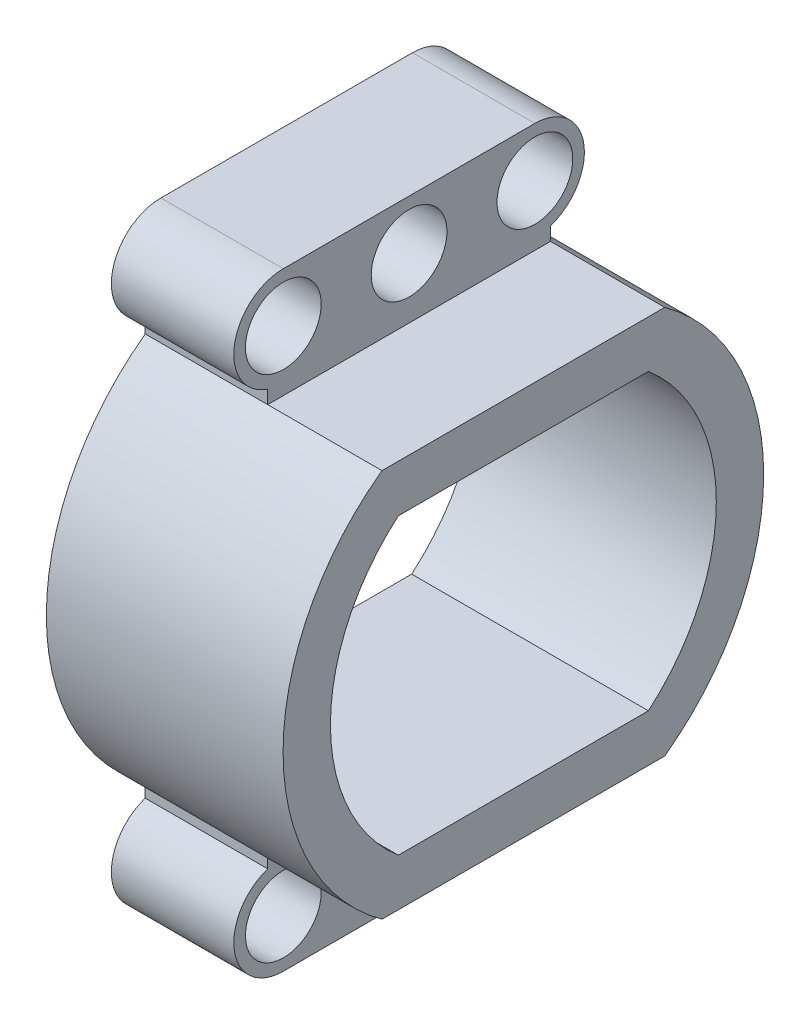
from build123d import *

# Parameters (mm, degrees)
MOTOR_HOLDER_DEPTH = 15
SKETCH2_R          = 2.4
LEGO_MOUNT_DEPTH   = 7.76


with BuildPart() as part:
    # Sketch1 → Motor Holder (new body)
    with BuildSketch(Plane(origin=(0, 0, 0), x_dir=(0, 0, -1), z_dir=(1, 0, 0))):
        with BuildLine():
            Line((-8.959047103, 12.31), (8.959047103, 12.31))
            ThreePointArc((8.959047103, 12.31), (15.225, 0), (8.959047103, -12.31))
            Line((8.959047103, -12.31), (-8.959047103, -12.31))
            ThreePointArc((-8.959047103, -12.31), (-15.225, 0), (-8.959047103, 12.31))
        make_face()
        with BuildLine():
            Line((-7.923037612, 9.31), (7.923037612, 9.31))
            ThreePointArc((7.923037612, 9.31), (12.225, 0), (7.923037612, -9.31))
            Line((7.923037612, -9.31), (-7.923037612, -9.31))
            ThreePointArc((-7.923037612, -9.31), (-12.225, 0), (-7.923037612, 9.31))
        make_face(mode=Mode.SUBTRACT)
    extrude(amount=MOTOR_HOLDER_DEPTH)

    # Sketch2 → Lego Mount (add)
    # profile 1 of 2: a face of its own
    with BuildSketch(Plane.ZY):
        with BuildLine():
            Line((-7.97, 19.277326297), (7.97, 19.277326297))
            ThreePointArc((7.97, 19.277326297), (11.067073538, 16.640950889), (8.959047103, 13.162651831))
            Line((8.959047103, 13.162651831), (8.959047103, 12.31))
            Line((8.959047103, 12.31), (-8.959047103, 12.31))
            Line((-8.959047103, 12.31), (-8.959047103, 13.162651831))
            ThreePointArc((-8.959047103, 13.162651831), (-11.067073538, 16.640950889), (-7.97, 19.277326297))
        make_face()
        with Locations((-7.97, 16.14)):
            Circle(SKETCH2_R, mode=Mode.SUBTRACT)
        with Locations((0, 16.14)):
            Circle(SKETCH2_R, mode=Mode.SUBTRACT)
        with Locations((7.97, 16.14)):
            Circle(SKETCH2_R, mode=Mode.SUBTRACT)
    # profile 2 of 2: a face of its own
    with BuildSketch(Plane.ZY):
        with BuildLine():
            Line((-7.97, -19.277326297), (7.97, -19.277326297))
            ThreePointArc((7.97, -19.277326297), (11.067073538, -16.640950889), (8.959047103, -13.162651831))
            Line((8.959047103, -13.162651831), (8.959047103, -12.31))
            Line((8.959047103, -12.31), (-8.959047103, -12.31))
            Line((-8.959047103, -12.31), (-8.959047103, -13.162651831))
            ThreePointArc((-8.959047103, -13.162651831), (-11.067073538, -16.640950889), (-7.97, -19.277326297))
        make_face()
        with Locations(Location((7.97, -16.14, 0), (0, 0, 180))):
            Circle(SKETCH2_R, mode=Mode.SUBTRACT)
        with Locations(Location((0, -16.14, 0), (0, 0, 180))):
            Circle(SKETCH2_R, mode=Mode.SUBTRACT)
        with Locations(Location((-7.97, -16.14, 0), (0, 0, 180))):
            Circle(SKETCH2_R, mode=Mode.SUBTRACT)
    extrude(amount=-LEGO_MOUNT_DEPTH)


solid = part.part
